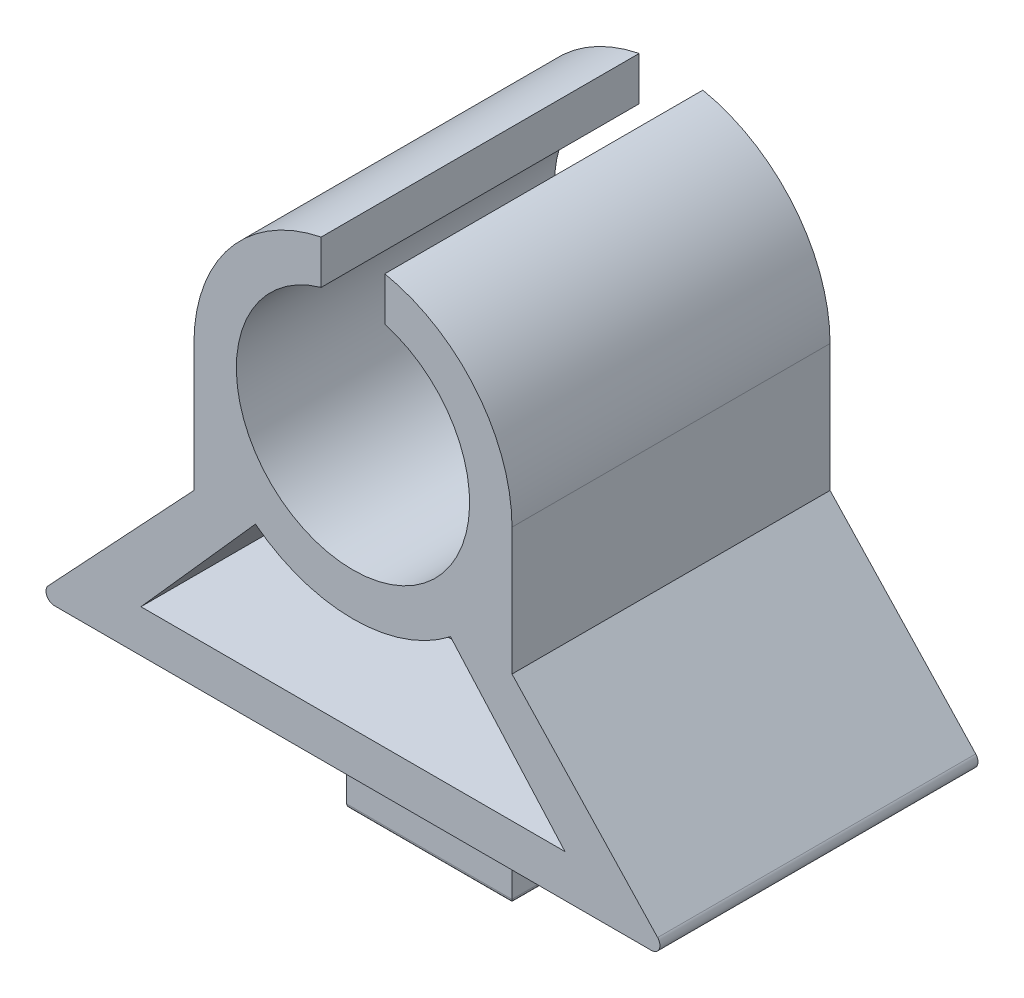
from build123d import *

# Parameters (mm, degrees)
EXTRUDE_1_DEPTH      = 3.75
EXTRUDE_1_DEPTH_BACK = 3.75
SKETCH_2_W           = 3
SKETCH_2_H           = 3
EXTRUDE_2_DEPTH      = 1
EXTRUDE_3_DEPTH      = 2
EXTRUDE_3_DEPTH_BACK = 2
CUT_EXTRUDE_1_REACH  = 16.741
CUT_EXTRUDE_START    = -3
CUT_EXTRUDE_2_DEPTH  = 3
CUT_EXTRUDE_START_2  = -7.5
CUT_EXTRUDE_3_DEPTH  = 3
FILLET_1_R           = 0.2
FILLET_2_R           = 0.1


with BuildPart() as part:
    # 草图1 → 凸台-拉伸1 (new, two sides: drawn at the far end of the back side and taken through both)
    with BuildSketch(Plane.XY.offset(-EXTRUDE_1_DEPTH_BACK)):
        with BuildLine():
            Line((-7.5, 0), (7.5, 0))
            Line((7.5, 0), (3.75, 4))
            Line((3.75, 4), (3.75, 7))
            ThreePointArc((3.75, 7), (2.90473751, 9.371708245), (0.75, 10.674234614))
            Line((0.75, 10.674234614), (0.75, 9.645751311))
            ThreePointArc((0.75, 9.645751311), (0, 4.25), (-0.75, 9.645751311))
            Line((-0.75, 9.645751311), (-0.75, 10.674234614))
            ThreePointArc((-0.75, 10.674234614), (-2.90473751, 9.371708245), (-3.75, 7))
            Line((-3.75, 7), (-3.75, 4))
            Line((-3.75, 4), (-7.5, 0))
        make_face()
    extrude(amount=EXTRUDE_1_DEPTH + EXTRUDE_1_DEPTH_BACK)

    # 草图2 → 凸台-拉伸2 (add)
    with BuildSketch(Plane.XZ):
        Rectangle(SKETCH_2_W, SKETCH_2_H)
    extrude(amount=EXTRUDE_2_DEPTH)

    # 草图3 → 凸台-拉伸3 (add, two sides: drawn at the far end of the back side and taken through both)
    with BuildSketch(Plane.XY.offset(-EXTRUDE_3_DEPTH_BACK)):
        with BuildLine():
            Line((-1.95, -2.5), (1.95, -2.5))
            Line((1.95, -2.5), (1.95, -1.555590279))
            ThreePointArc((1.95, -1.555590279), (1.780042303, -1.088161527), (1.5, -0.677124344))
            Line((1.5, -0.677124344), (-1.5, -0.677124344))
            ThreePointArc((-1.5, -0.677124344), (-1.780042303, -1.088161527), (-1.95, -1.555590279))
            Line((-1.95, -1.555590279), (-1.95, -2.5))
        make_face()
    extrude(amount=EXTRUDE_3_DEPTH + EXTRUDE_3_DEPTH_BACK)

    # 草图4 → 切除-拉伸1 (cut, up to next)
    with BuildSketch(Plane.ZY.offset(1.95), mode=Mode.PRIVATE) as cut_extrude_1_sk1:
        with BuildLine():
            Line((-1.95, -2.5), (-1.95, -1.555590279))
            ThreePointArc((-1.95, -1.555590279), (-1.780042303, -1.088161527), (-1.5, -0.677124344))
            Line((-1.5, -0.677124344), (-2, -0.677124344))
            Line((-2, -0.677124344), (-2, -2.5))
            Line((-2, -2.5), (-1.95, -2.5))
        make_face()
    cut_extrude_1_tool1 = extrude(cut_extrude_1_sk1.sketch, amount=-CUT_EXTRUDE_1_REACH, mode=Mode.PRIVATE) & part.part
    # 草图4 → 切除-拉伸1 (cut, up to next)
    with BuildSketch(Plane.ZY.offset(1.95), mode=Mode.PRIVATE) as cut_extrude_1_sk2:
        with BuildLine():
            Line((1.95, -2.5), (1.95, -1.555590279))
            ThreePointArc((1.95, -1.555590279), (1.780042303, -1.088161527), (1.5, -0.677124344))
            Line((1.5, -0.677124344), (2, -0.677124344))
            Line((2, -0.677124344), (2, -2.5))
            Line((2, -2.5), (1.95, -2.5))
        make_face()
    cut_extrude_1_tool2 = extrude(cut_extrude_1_sk2.sketch, amount=-CUT_EXTRUDE_1_REACH, mode=Mode.PRIVATE) & part.part
    add(cut_extrude_1_tool1.solids().sort_by_distance((-1.95, -1.175075, -1.873038))[0], mode=Mode.SUBTRACT)
    add(cut_extrude_1_tool2.solids().sort_by_distance((-1.95, -1.175075, 1.873038))[0], mode=Mode.SUBTRACT)

    # 草图5 → 切除-拉伸2 (cut)
    with BuildSketch(Plane.XY.offset(3.75).offset(CUT_EXTRUDE_START)):
        with BuildLine():
            Line((-5, 1), (5, 1))
            Line((5, 1), (2.299653235, 4.03789011))
            ThreePointArc((2.299653235, 4.03789011), (0, 3.25), (-2.299653235, 4.03789011))
            Line((-2.299653235, 4.03789011), (-5, 1))
        make_face()
    extrude(amount=CUT_EXTRUDE_2_DEPTH, mode=Mode.SUBTRACT)

    # 草图5<2> → 切除-拉伸3 (cut)
    with BuildSketch(Plane.XY.offset(3.75).offset(CUT_EXTRUDE_START_2)):
        with BuildLine():
            Line((-5, 1), (5, 1))
            Line((5, 1), (2.299653235, 4.03789011))
            ThreePointArc((2.299653235, 4.03789011), (0, 3.25), (-2.299653235, 4.03789011))
            Line((-2.299653235, 4.03789011), (-5, 1))
        make_face()
    extrude(amount=CUT_EXTRUDE_3_DEPTH, mode=Mode.SUBTRACT)

    # 圆角1
    fillet_1_edges = [part.edges().sort_by_distance(p)[0] for p in [
        (-7.5, 0, 0),
        (7.5, 0, 0),
    ]]
    fillet(fillet_1_edges, radius=FILLET_1_R)

    # 圆角2
    fillet_2_edges = [part.edges().sort_by_distance(p)[0] for p in [
        (0, -2.5, -1.95),
        (-1.95, -2.5, 0),
        (0, -2.5, 1.95),
        (1.95, -2.5, 0),
    ]]
    fillet(fillet_2_edges, radius=FILLET_2_R)


solid = part.part
